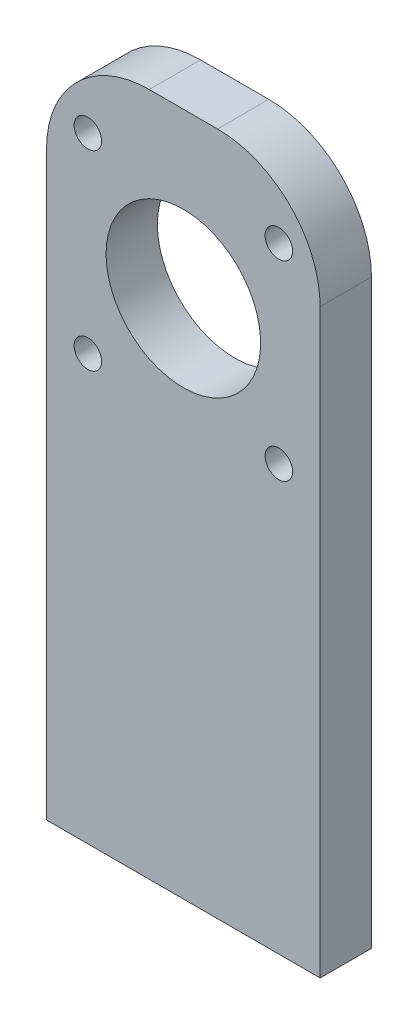
from build123d import *

# Parameters (mm, degrees)
SKETCH2_W           = 50.8
SKETCH2_H           = 127
SKETCH2_R           = 14.351
SKETCH2_R_2         = 2.5527
BOSS_EXTRUDE3_DEPTH = 9.525
FILLET1_R           = 19.05
FILLET4_R           = 19.05


with BuildPart() as part:
    # Sketch2 → Boss-Extrude3 (new body)
    with BuildSketch(Plane.XY):
        with Locations((25.4, 63.5)):
            Rectangle(SKETCH2_W, SKETCH2_H)
        with Locations(Location((25.4, 96.5708, 0), (0, 0, 180))):
            Circle(SKETCH2_R, mode=Mode.SUBTRACT)
        with Locations(Location((43.1292, 114.3, 0), (0, 0, 180))):
            Circle(SKETCH2_R_2, mode=Mode.SUBTRACT)
        with Locations(Location((7.6708, 114.3, 0), (0, 0, 180))):
            Circle(SKETCH2_R_2, mode=Mode.SUBTRACT)
        with Locations(Location((7.6708, 78.8416, 0), (0, 0, 180))):
            Circle(SKETCH2_R_2, mode=Mode.SUBTRACT)
        with Locations(Location((43.1292, 78.8416, 0), (0, 0, 180))):
            Circle(SKETCH2_R_2, mode=Mode.SUBTRACT)
    extrude(amount=BOSS_EXTRUDE3_DEPTH)

    # Fillet1
    fillet1_edges = [part.edges().sort_by_distance(p)[0] for p in [
        (50.8, 127, 4.7625),
    ]]
    fillet(fillet1_edges, radius=FILLET1_R)

    # Fillet4
    fillet4_edges = [part.edges().sort_by_distance(p)[0] for p in [
        (0, 127, 4.7625),
    ]]
    fillet(fillet4_edges, radius=FILLET4_R)


solid = part.part
